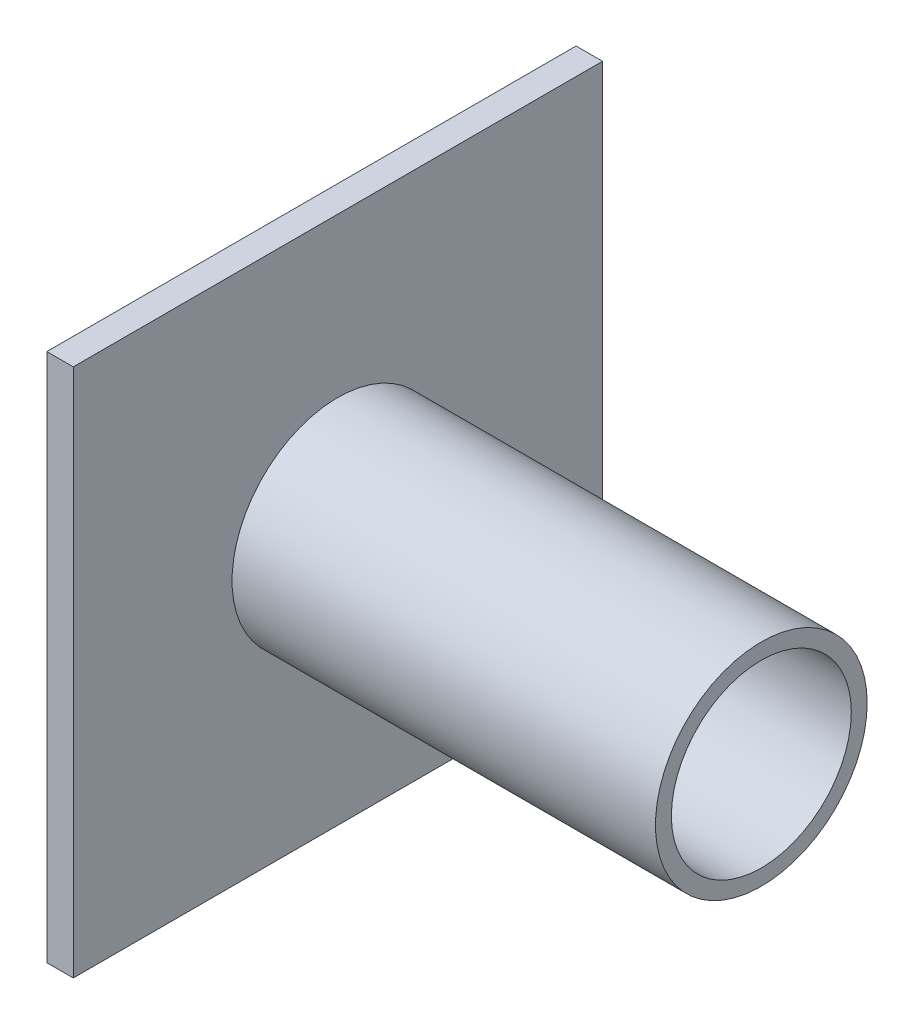
from build123d import *

# Parameters (mm, degrees)
SKETCH1_W           = 100
SKETCH1_H           = 100
BOSS_EXTRUDE1_DEPTH = 5
SKETCH2_R           = 20
BOSS_EXTRUDE2_DEPTH = 80
SHELL1_T            = -3


with BuildPart() as part:
    # Sketch1 → Boss-Extrude1 (new body)
    with BuildSketch(Plane(origin=(0, 0, 0), x_dir=(0, 0, -1), z_dir=(1, 0, 0))):
        Rectangle(SKETCH1_W, SKETCH1_H)
    extrude(amount=BOSS_EXTRUDE1_DEPTH)

    # Sketch2 → Boss-Extrude2 (add)
    with BuildSketch(Plane(origin=(5, 0, 0), x_dir=(0, 0, -1), z_dir=(1, 0, 0))):
        Circle(SKETCH2_R)
    extrude(amount=BOSS_EXTRUDE2_DEPTH)

    # Shell1
    shell1_openings = [part.faces().sort_by_distance(p)[0] for p in [
        (85, 0, 0),
    ]]
    offset(amount=SHELL1_T, openings=shell1_openings, kind=Kind.INTERSECTION)


solid = part.part
